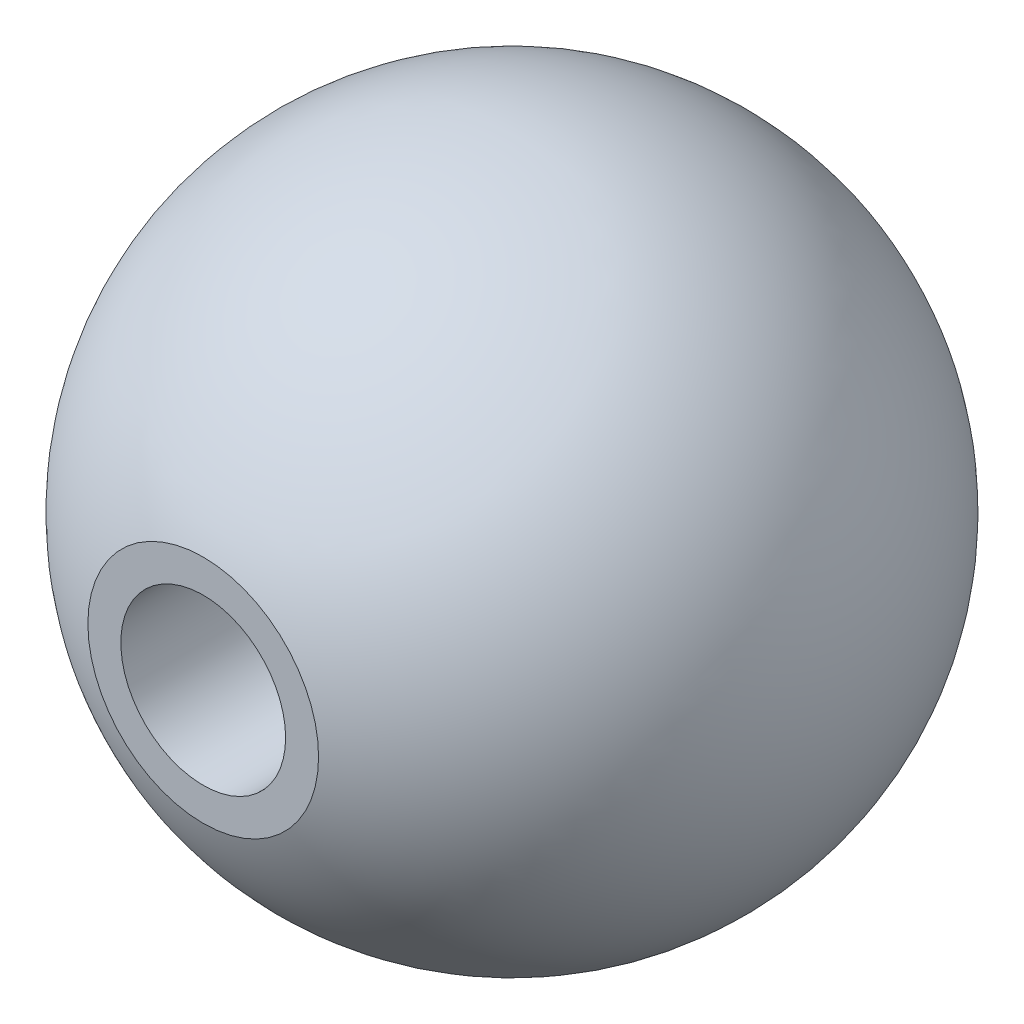
from build123d import *

# Parameters (mm, degrees)
CUT_EXTRUDE1_START = 11.896721
SKETCH3_R          = 4.445
CUT_EXTRUDE1_DEPTH = 2.54
SKETCH4_R          = 3.175
CUT_EXTRUDE2_DEPTH = 7.62


with BuildPart() as part:
    # Sketch2 → Revolve2 (revolve)
    with BuildSketch(Plane.XY):
        with BuildLine():
            Line((0, 12.7), (0, -12.7))
            ThreePointArc((0, -12.7), (12.7, 0), (0, 12.7))
        make_face()
    revolve(axis=Axis((0, 0, 0), (0, 1, 0)))

    # Sketch3 → Cut-Extrude1 (cut)
    with BuildSketch(Plane.XY.offset(CUT_EXTRUDE1_START)):
        Circle(SKETCH3_R)
    cut_extrude1 = extrude(amount=CUT_EXTRUDE1_DEPTH, mode=Mode.SUBTRACT)

    # Sketch4 → Cut-Extrude2 (cut)
    with BuildSketch(Plane.XY.offset(11.896721187)):
        Circle(SKETCH4_R)
    cut_extrude2 = extrude(amount=-CUT_EXTRUDE2_DEPTH, mode=Mode.SUBTRACT)

    # Mirror1: Cut-Extrude1, Cut-Extrude2 across plane
    add(cut_extrude1.mirror(Plane.XY), mode=Mode.SUBTRACT)
    add(cut_extrude2.mirror(Plane.XY), mode=Mode.SUBTRACT)


solid = part.part
